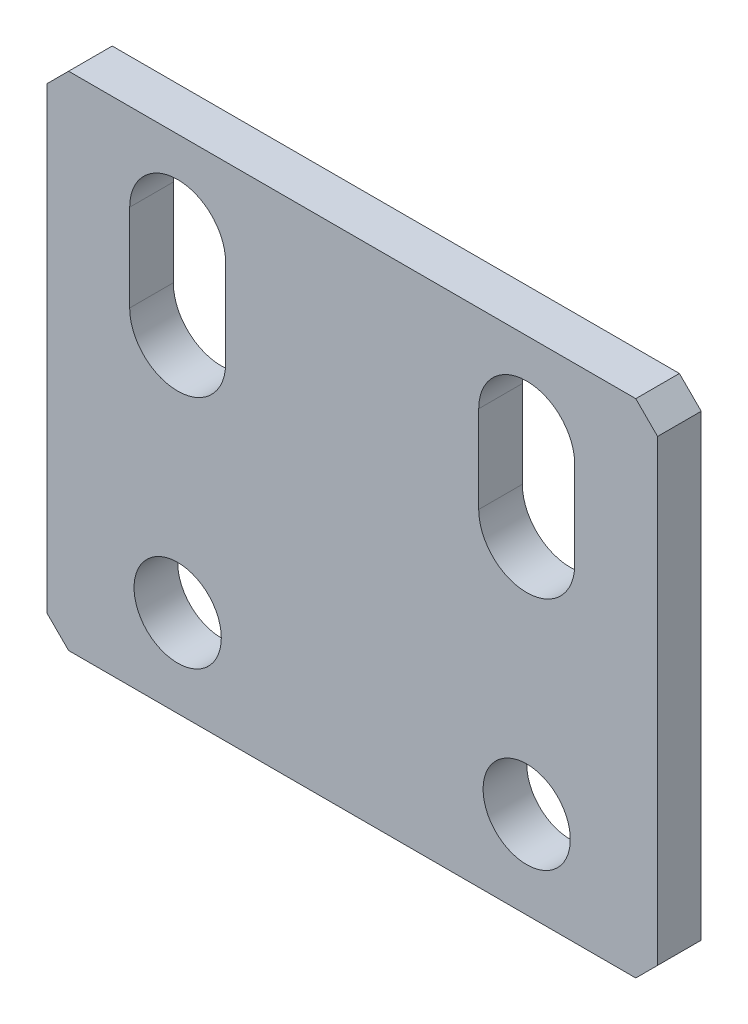
from build123d import *

# Parameters (mm, degrees)
ESQUISSE1_W             = 28
ESQUISSE1_H             = 23
BOSS_EXTRU_1_DEPTH      = 2
ESQUISSE2_R             = 2
ENL_V_MAT_EXTRU_1_DEPTH = 37.290494623
CHANFREIN1_SIZE         = 1


with BuildPart() as part:
    # Esquisse1 → Boss.-Extru.1 (new body)
    with BuildSketch(Plane.XY):
        with Locations((14, 11.5)):
            Rectangle(ESQUISSE1_W, ESQUISSE1_H)
    extrude(amount=BOSS_EXTRU_1_DEPTH)

    # Esquisse2 → Enlèv. mat.-Extru.1 (cut, through all)
    with BuildSketch(Plane.XY.offset(2)):
        with Locations((6, 4)):
            Circle(ESQUISSE2_R)
        with Locations(Location((22, 4, 0), (0, 0, 180))):
            Circle(ESQUISSE2_R)
        with BuildLine():
            Line((8.2, 19), (8.2, 15))
            ThreePointArc((8.2, 15), (6, 12.8), (3.8, 15))
            Line((3.8, 15), (3.8, 19))
            ThreePointArc((3.8, 19), (6, 21.2), (8.2, 19))
        make_face()
        with BuildLine():
            Line((19.8, 19), (19.8, 15))
            ThreePointArc((19.8, 15), (22, 12.8), (24.2, 15))
            Line((24.2, 15), (24.2, 19))
            ThreePointArc((24.2, 19), (22, 21.2), (19.8, 19))
        make_face()
    extrude(amount=-ENL_V_MAT_EXTRU_1_DEPTH, mode=Mode.SUBTRACT)

    # Chanfrein1
    chanfrein1_edges = [part.edges().sort_by_distance(p)[0] for p in [
        (0, 23, 1),
        (28, 23, 1),
        (28, 0, 1),
        (0, 0, 1),
    ]]
    chamfer(chanfrein1_edges, length=CHANFREIN1_SIZE)


solid = part.part
